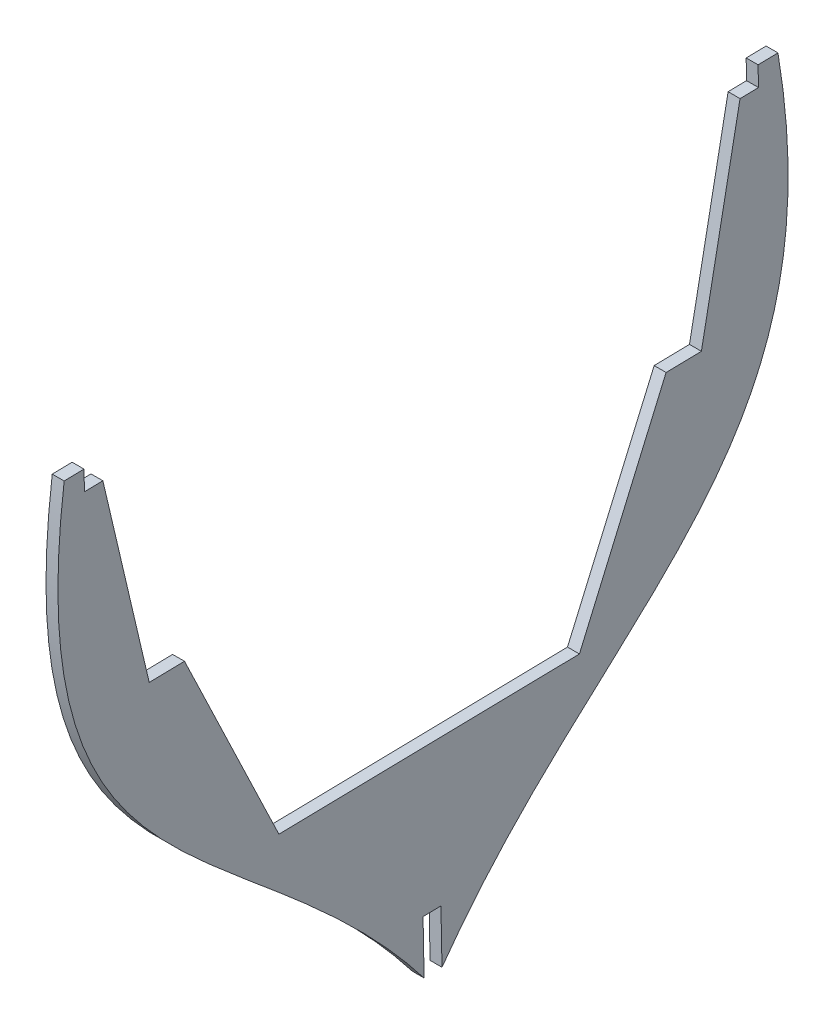
from build123d import *

# Parameters (mm, degrees)
BOSS_EXTRU_3_DEPTH      = 6
ENL_V_MAT_EXTRU_1_DEPTH = 6


with BuildPart() as part:
    # Esquisse2 → Boss.-Extru.3 (new body)
    with BuildSketch(Plane(origin=(0, 0, 0), x_dir=(0, 0, -1), z_dir=(1, 0, 0))):
        with BuildLine():
            Line((-186.314870475, 343.126909424), (-176.316754144, 343.320996586))
            Line((-176.316754144, 343.320996586), (-176.122666982, 333.322880254))
            Line((-176.122666982, 333.322880254), (-166.846574289, 333.502951224))
            Line((-166.846574289, 333.502951224), (-143.518291854, 233.936968303))
            Line((-143.518291854, 233.936968303), (-125.749671338, 234.281899389))
            Line((-125.749671338, 234.281899389), (-78.26041194, 135.18493836))
            Line((-78.26041194, 135.18493836), (72.954907085, 138.120386506))
            Line((72.954907085, 138.120386506), (116.562423252, 238.985752103))
            Line((116.562423252, 238.985752103), (134.331043769, 239.330683189))
            Line((134.331043769, 239.330683189), (153.777582972, 339.727026894))
            Line((153.777582972, 339.727026894), (163.053675666, 339.907097863))
            Line((163.053675666, 339.907097863), (162.859588505, 349.905214195))
            Line((162.859588505, 349.905214195), (172.857704836, 350.099301356))
            add(Edge.make_bspline(
                [(172.857704836, 350.099301356), (204.384261901, 162.8071682), (83.498136197, 153.642271532), (-0.579687579, 29.861757988)],
                knots=[0, 0, 0, 0, 1, 1, 1, 1], degree=3))
            add(Edge.make_bspline(
                [(-186.314870475, 343.126909424), (-210.548845306, 154.752332035), (-89.398104046, 150.285945261), (-0.579687579, 29.861757988)],
                knots=[0, 0, 0, 0, 1, 1, 1, 1], degree=3))
        make_face()
    extrude(amount=BOSS_EXTRU_3_DEPTH)

    # Esquisse3 → Enlèv. mat.-Extru.1 (cut)
    with BuildSketch(Plane(origin=(6, 0, 0), x_dir=(0, 0, -1), z_dir=(1, 0, 0))):
        Polygon((-5.199417696, 35.985806185), (-5.723453032, 62.98072028), (3.274851666, 63.155398725), (3.798887002, 36.160484631), (13.09005186, 25.116564572), (-12.278264547, 26.928587172), align=None)
    extrude(amount=-ENL_V_MAT_EXTRU_1_DEPTH, mode=Mode.SUBTRACT)


solid = part.part
